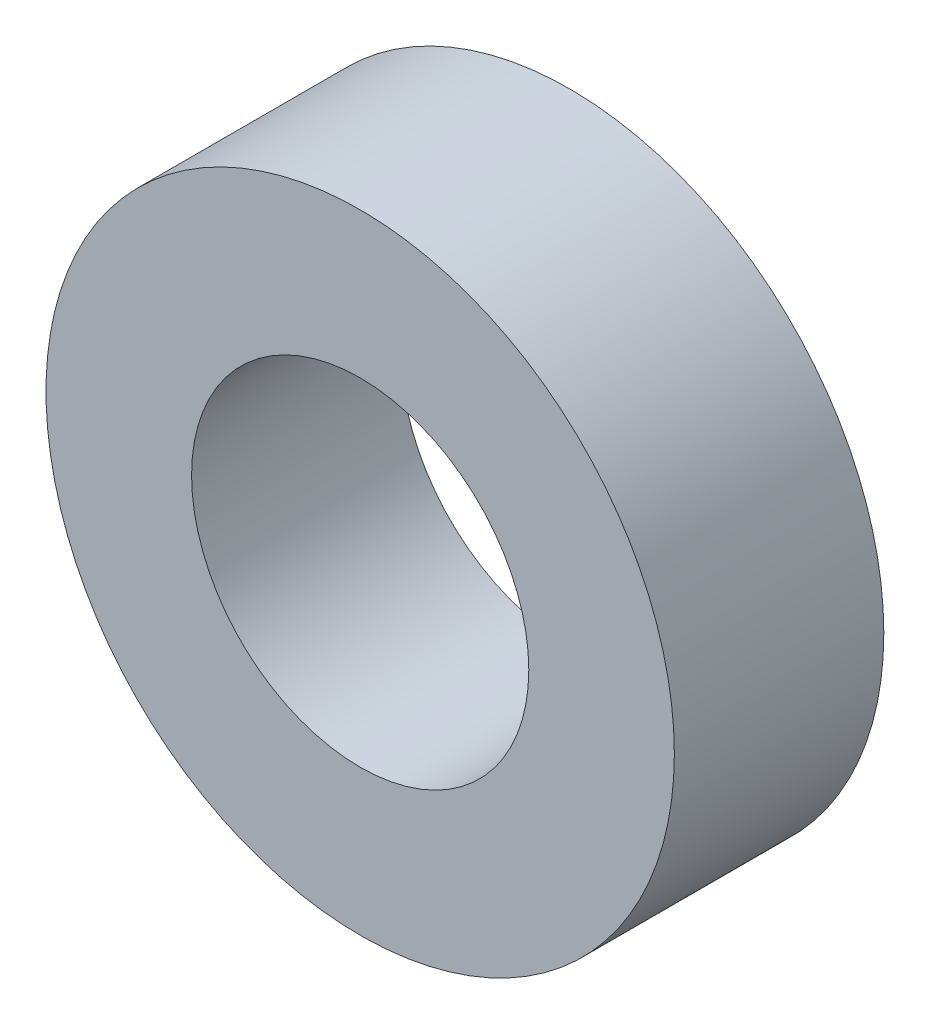
from build123d import *

# Parameters (mm, degrees)
SKETCH1_R           = 3
SKETCH1_R_2         = 1.61
BOSS_EXTRUDE1_DEPTH = 2


with BuildPart() as part:
    # Sketch1 → Boss-Extrude1 (new body)
    with BuildSketch(Plane.XY):
        Circle(SKETCH1_R)
        Circle(SKETCH1_R_2, mode=Mode.SUBTRACT)
    extrude(amount=BOSS_EXTRUDE1_DEPTH)


solid = part.part
